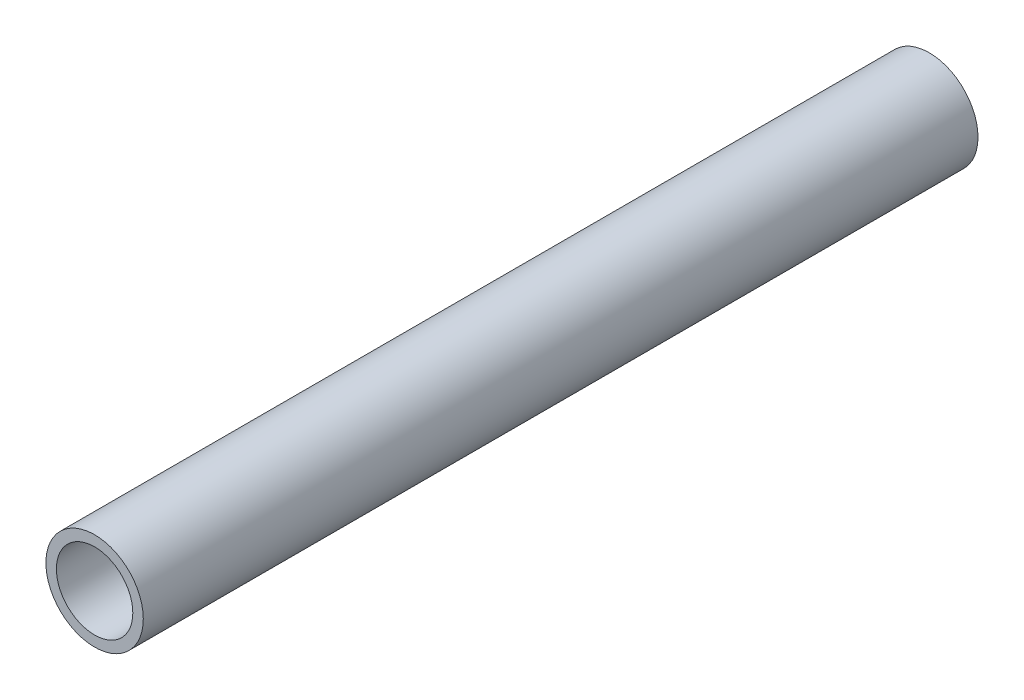
from build123d import *

# Parameters (mm, degrees)
SKETCH1_R           = 13.335
SKETCH1_R_2         = 10.4648
BOSS_EXTRUDE1_DEPTH = 228.6


with BuildPart() as part:
    # Sketch1 → Boss-Extrude1 (new body)
    with BuildSketch(Plane.XY):
        Circle(SKETCH1_R)
        Circle(SKETCH1_R_2, mode=Mode.SUBTRACT)
    extrude(amount=BOSS_EXTRUDE1_DEPTH)


solid = part.part
